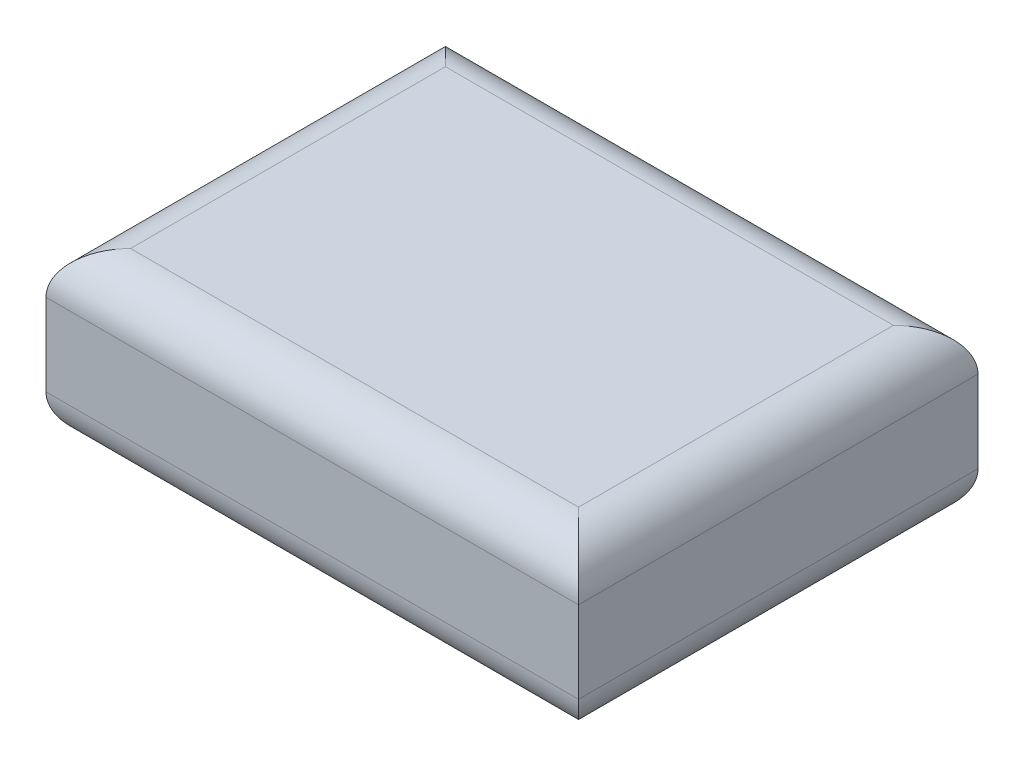
from build123d import *

# Parameters (mm, degrees)
SKETCH1_W           = 16
SKETCH1_H           = 5
BOSS_EXTRUDE1_DEPTH = 12
FILLET3_R           = 1.27


with BuildPart() as part:
    # Sketch1 → Boss-Extrude1 (new body)
    with BuildSketch(Plane.XY):
        with Locations((8, 2.5)):
            Rectangle(SKETCH1_W, SKETCH1_H)
    extrude(amount=BOSS_EXTRUDE1_DEPTH)

    # Fillet3
    fillet3_edges = [part.edges().sort_by_distance(p)[0] for p in [
        (8, 5, 12),
        (8, 5, 0),
        (8, 0, 0),
        (8, 0, 12),
        (0, 5, 6),
        (16, 5, 6),
        (16, 0, 6),
        (0, 0, 6),
    ]]
    fillet(fillet3_edges, radius=FILLET3_R)


solid = part.part
